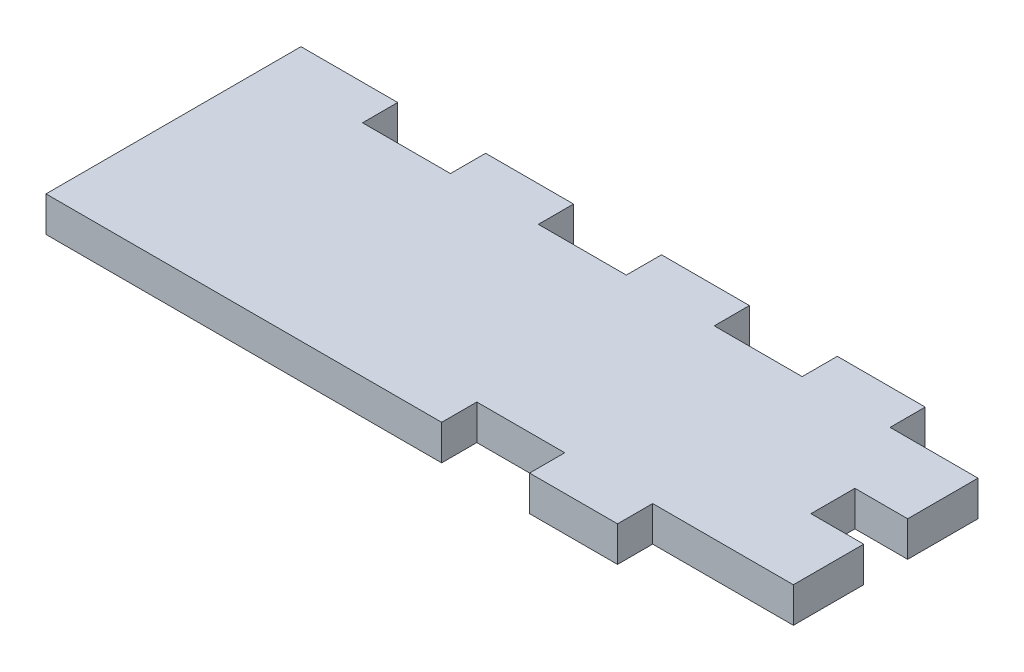
from build123d import *

# Parameters (mm, degrees)
SKETCH1_W           = 75
SKETCH1_H           = 21
BOSS_EXTRUDE1_DEPTH = 4
SKETCH2_W           = 8
SKETCH2_H           = 4
BOSS_EXTRUDE2_DEPTH = 6
SKETCH3_W           = 10
SKETCH3_H           = 4
BOSS_EXTRUDE3_DEPTH = 4
LPATTERN1_COUNT     = 4
LPATTERN1_PITCH     = 20
SKETCH4_W           = 1
SKETCH4_H           = 4
BOSS_EXTRUDE4_DEPTH = 4
SKETCH5_W           = 45
SKETCH5_H           = 4
SKETCH5_W_2         = 10
BOSS_EXTRUDE5_DEPTH = 4


with BuildPart() as part:
    # Sketch1 → Boss-Extrude1 (new body)
    with BuildSketch(Plane(origin=(0, 0, 0), x_dir=(1, 0, 0), z_dir=(0, 1, 0))):
        with Locations((37.5, -10.5)):
            Rectangle(SKETCH1_W, SKETCH1_H)
    extrude(amount=BOSS_EXTRUDE1_DEPTH)

    # Sketch2 → Boss-Extrude2 (add)
    with BuildSketch(Plane(origin=(75, 0, 0), x_dir=(0, 0, -1), z_dir=(1, 0, 0))):
        with Locations((-17, 2)):
            Rectangle(SKETCH2_W, SKETCH2_H)
        with Locations((-4, 2)):
            Rectangle(SKETCH2_W, SKETCH2_H)
    extrude(amount=BOSS_EXTRUDE2_DEPTH)

    # Sketch3 → Boss-Extrude3 (add, through all)
    with BuildSketch(Plane(origin=(0, 4, 0), x_dir=(1, 0, 0), z_dir=(0, 1, 0))):
        with Locations((66, 2)):
            Rectangle(SKETCH3_W, SKETCH3_H)
    boss_extrude3 = extrude(amount=-BOSS_EXTRUDE3_DEPTH)

    # LPattern1: Boss-Extrude3 ×4
    with Locations(*[(-i * LPATTERN1_PITCH, 0, 0) for i in range(1, LPATTERN1_COUNT)]):
        add(boss_extrude3)

    # Sketch4 → Boss-Extrude4 (add, through all)
    with BuildSketch(Plane(origin=(0, 4, 0), x_dir=(1, 0, 0), z_dir=(0, 1, 0))):
        with Locations((0.5, 2)):
            Rectangle(SKETCH4_W, SKETCH4_H)
    extrude(amount=-BOSS_EXTRUDE4_DEPTH)

    # Sketch5 → Boss-Extrude5 (add, through all)
    with BuildSketch(Plane(origin=(0, 4, 0), x_dir=(1, 0, 0), z_dir=(0, 1, 0))):
        with Locations((22.5, -23)):
            Rectangle(SKETCH5_W, SKETCH5_H)
        with Locations((60, -23)):
            Rectangle(SKETCH5_W_2, SKETCH5_H)
    extrude(amount=-BOSS_EXTRUDE5_DEPTH)


solid = part.part
